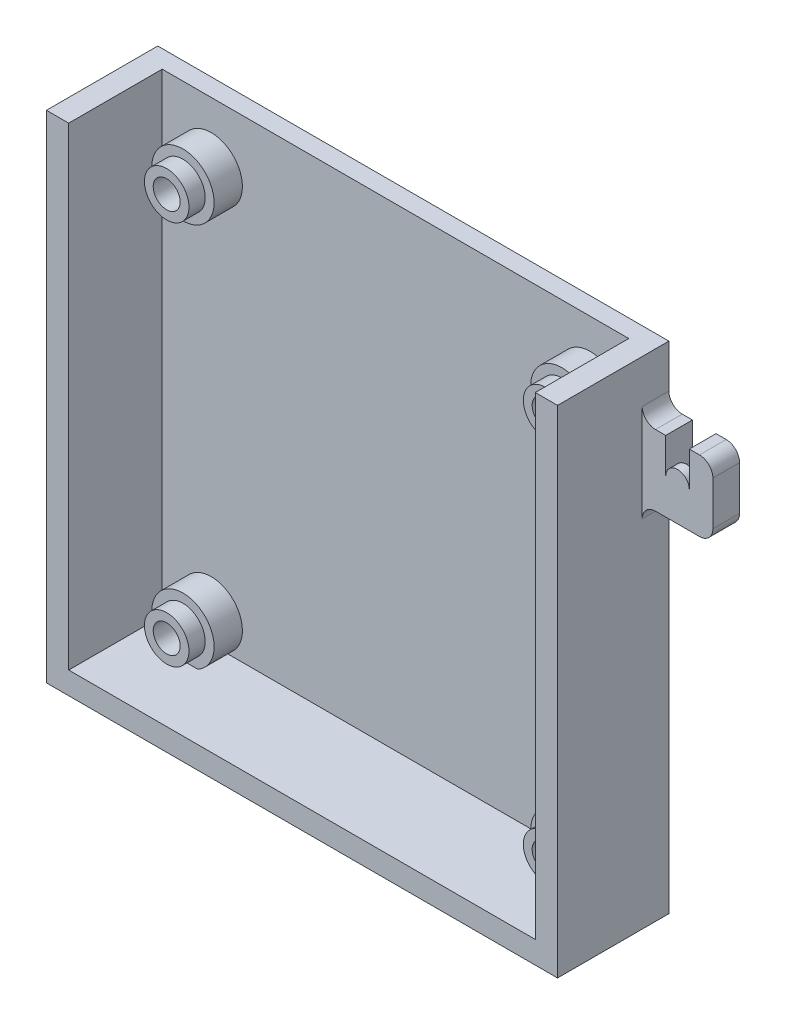
from build123d import *

# Parameters (mm, degrees)
SKETCH1_W                     = 104.775
SKETCH1_H                     = 106.3625
BOSS_EXTRUDE1_DEPTH           = 4
BOSS_EXTRUDE2_DEPTH           = 25
SKETCH3_R                     = 5
SKETCH3_R_2                   = 3.025
BOSS_EXTRUDE3_DEPTH           = 10
SKETCH4_R                     = 7
SKETCH4_R_2                   = 3.025
BOSS_EXTRUDE4_DEPTH           = 6.35
SKETCH6_W                     = 15.875
SKETCH6_H                     = 15.875
SKETCH6_W_2                   = 15.88
SKETCH6_H_2                   = 15.88
BOSS_EXTRUDE5_DEPTH           = 6
SKETCH8_W                     = 2.65
SKETCH8_H                     = 4
M5_CLEARANCE_HOLE2_AT_2_COUNT = 2
M5_CLEARANCE_HOLE2_AT_2_PITCH = 154.672014215
FILLET2_R                     = 3
CUT_EXTRUDE1_DEPTH            = 96.468237691


with BuildPart() as part:
    # Sketch1 → Boss-Extrude1 (new body)
    with BuildSketch(Plane.XY):
        Rectangle(SKETCH1_W, SKETCH1_H)
    extrude(amount=BOSS_EXTRUDE1_DEPTH)

    # Sketch2 → Boss-Extrude2 (add)
    with BuildSketch(Plane.XY):
        Polygon((-57.3875, -53.18125), (-57.3875, -58.18125), (-52.3875, -58.18125), (57.3875, -58.18125), (57.3875, 53.18125), (52.3875, 53.18125), (52.3875, -53.18125), (-52.3875, -53.18125), (-52.3875, 53.18125), (-57.3875, 53.18125), align=None)
    extrude(amount=BOSS_EXTRUDE2_DEPTH)

    # Sketch3 → Boss-Extrude3 (add)
    # profile 1 of 4: a face of its own
    with BuildSketch(Plane.XY.offset(4)):
        with Locations((43.708, 39.35095)):
            Circle(SKETCH3_R)
        with Locations((43.708, 39.35095)):
            Circle(SKETCH3_R_2, mode=Mode.SUBTRACT)
    # profile 2 of 4: a face of its own
    with BuildSketch(Plane.XY.offset(4)):
        with Locations((-41.382, 39.35095)):
            Circle(SKETCH3_R)
        with Locations((-41.382, 39.35095)):
            Circle(SKETCH3_R_2, mode=Mode.SUBTRACT)
    # profile 3 of 4: a face of its own
    with BuildSketch(Plane.XY.offset(4)):
        with Locations((-41.382, -47.00905)):
            Circle(SKETCH3_R)
        with Locations((-41.382, -47.00905)):
            Circle(SKETCH3_R_2, mode=Mode.SUBTRACT)
    # profile 4 of 4: a face of its own
    with BuildSketch(Plane.XY.offset(4)):
        with Locations((43.708, -47.00905)):
            Circle(SKETCH3_R)
        with Locations((43.708, -47.00905)):
            Circle(SKETCH3_R_2, mode=Mode.SUBTRACT)
    extrude(amount=BOSS_EXTRUDE3_DEPTH)

    # Sketch4 → Boss-Extrude4 (add)
    # profile 1 of 4: a face of its own
    with BuildSketch(Plane.XY.offset(4)):
        with Locations((43.708, 39.35095)):
            Circle(SKETCH4_R)
        with Locations((43.708, 39.35095)):
            Circle(SKETCH4_R_2, mode=Mode.SUBTRACT)
    # profile 2 of 4: a face of its own
    with BuildSketch(Plane.XY.offset(4)):
        with Locations((-41.382, 39.35095)):
            Circle(SKETCH4_R)
        with Locations((-41.382, 39.35095)):
            Circle(SKETCH4_R_2, mode=Mode.SUBTRACT)
    # profile 3 of 4: a face of its own
    with BuildSketch(Plane.XY.offset(4)):
        with Locations((-41.382, -47.00905)):
            Circle(SKETCH4_R)
        with Locations((-41.382, -47.00905)):
            Circle(SKETCH4_R_2, mode=Mode.SUBTRACT)
    # profile 4 of 4: a face of its own
    with BuildSketch(Plane.XY.offset(4)):
        with Locations((43.708, -47.00905)):
            Circle(SKETCH4_R)
        with Locations((43.708, -47.00905)):
            Circle(SKETCH4_R_2, mode=Mode.SUBTRACT)
    extrude(amount=BOSS_EXTRUDE4_DEPTH)

    # Sketch6 → Boss-Extrude5 (add)
    with BuildSketch(Plane.XY):
        with Locations((65.325, 32.54375)):
            Rectangle(SKETCH6_W, SKETCH6_H)
        with Locations((-65.3275, -50.24125)):
            Rectangle(SKETCH6_W_2, SKETCH6_H_2)
    extrude(amount=BOSS_EXTRUDE5_DEPTH)

    # Sketch8 → M5 Clearance Hole2 (revolve, cut)
    with BuildSketch(Plane(origin=(65.325, 32.54375, 4), x_dir=(0, -1, 0), z_dir=(1, 0, 0))):
        with Locations((1.325, 2)):
            Rectangle(SKETCH8_W, SKETCH8_H)
    m5_clearance_hole2 = revolve(axis=Axis((65.325, 32.54375, 10.35), (0, 0, -1)), mode=Mode.SUBTRACT)

    # M5 Clearance Hole2 at 2: M5 Clearance Hole2 ×2
    with Locations(*[Vector(-0.8447067859256896, -0.5352293394528098, 0) * (i * M5_CLEARANCE_HOLE2_AT_2_PITCH) for i in range(1, M5_CLEARANCE_HOLE2_AT_2_COUNT)]):
        add(m5_clearance_hole2, mode=Mode.SUBTRACT)

    # Fillet2
    fillet2_edges = [part.edges().sort_by_distance(p)[0] for p in [
        (-73.2675, -42.30125, 3),
        (-73.2675, -58.18125, 3),
        (73.2625, 24.60625, 3),
        (73.2625, 40.48125, 3),
        (57.3875, 40.48125, 3),
        (57.3875, 24.60625, 3),
    ]]
    fillet(fillet2_edges, radius=FILLET2_R)

    # Sketch11 → Cut-Extrude1 (cut, through all)
    with BuildSketch(Plane.XY.offset(6)):
        with BuildLine():
            Line((-67.9775, -42.30125), (-67.9775, -50.24125))
            ThreePointArc((-67.9775, -50.24125), (-65.3275, -47.59125), (-62.6775, -50.24125))
            Line((-62.6775, -50.24125), (-62.6775, -42.30125))
            Line((-62.6775, -42.30125), (-67.9775, -42.30125))
        make_face()
        with BuildLine():
            Line((62.675, 40.48125), (62.675, 32.54375))
            ThreePointArc((62.675, 32.54375), (65.325, 35.19375), (67.975, 32.54375))
            Line((67.975, 32.54375), (67.975, 40.48125))
            Line((67.975, 40.48125), (62.675, 40.48125))
        make_face()
    extrude(amount=-CUT_EXTRUDE1_DEPTH, mode=Mode.SUBTRACT)


solid = part.part
